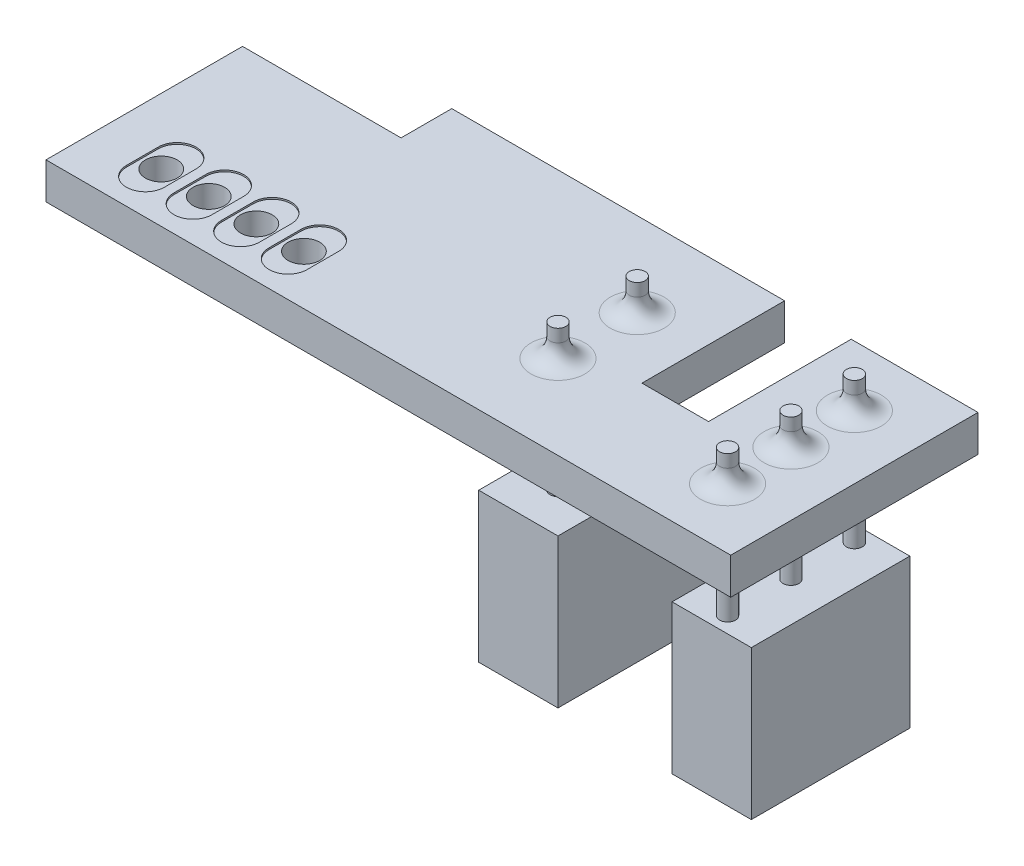
from build123d import *

# Parameters (mm, degrees)
SKETCH1_R                = 0.5
BOSS_EXTRUDE1_DEPTH      = 1.15
BOSS_EXTRUDE2_DEPTH      = 1
BOSS_EXTRUDE2_DEPTH_BACK = 3.6
SKETCH2_R                = 0.25
SKETCH3_W                = 2.5
SKETCH3_H                = 5
BOSS_EXTRUDE3_DEPTH      = 4.7
CUT_EXTRUDE1_DEPTH       = 0.05
FILLET1_R                = 0.6


with BuildPart() as part:
    # Sketch1 → Boss-Extrude1 (new body)
    with BuildSketch(Plane(origin=(0, 0, 0), x_dir=(1, 0, 0), z_dir=(0, 1, 0))):
        Polygon((-16.6, 0), (-16.6, -1.6), (-21.6, -1.6), (-21.6, -7.8), (0, -7.8), (0, 0), (-4, 0), (-4, -4.5), (-6.1, -4.5), (-6.1, 0), align=None)
        with Locations((-19.582016598, -6.182152405)):
            Circle(SKETCH1_R, mode=Mode.SUBTRACT)
        with Locations((-18.082016598, -6.182152405)):
            Circle(SKETCH1_R, mode=Mode.SUBTRACT)
        with Locations((-16.582016598, -6.182152405)):
            Circle(SKETCH1_R, mode=Mode.SUBTRACT)
        with Locations((-15.082016598, -6.182152405)):
            Circle(SKETCH1_R, mode=Mode.SUBTRACT)
    extrude(amount=BOSS_EXTRUDE1_DEPTH)

    # Sketch2 → Boss-Extrude2 (add, two sides: drawn at the far end of the back side and taken through both)
    with BuildSketch(Plane(origin=(0, 1.15, 0), x_dir=(1, 0, 0), z_dir=(0, 1, 0)).offset(-BOSS_EXTRUDE2_DEPTH_BACK)):
        with Locations((-8.1, -2.65)):
            Circle(SKETCH2_R)
        with Locations((-8.1, -5.15)):
            Circle(SKETCH2_R)
        with Locations((-2, -5.9)):
            Circle(SKETCH2_R)
        with Locations((-2, -1.9)):
            Circle(SKETCH2_R)
        with Locations((-2, -3.9)):
            Circle(SKETCH2_R)
    extrude(amount=BOSS_EXTRUDE2_DEPTH + BOSS_EXTRUDE2_DEPTH_BACK)

    # Sketch3 → Boss-Extrude3 (add)
    with BuildSketch(Plane.XZ.offset(2.45)):
        with Locations((-8.1, 3.9)):
            Rectangle(SKETCH3_W, SKETCH3_H)
        with Locations((-2, 3.9)):
            Rectangle(SKETCH3_W, SKETCH3_H)
    extrude(amount=BOSS_EXTRUDE3_DEPTH)

    # Sketch4 → Cut-Extrude1 (cut)
    with BuildSketch(Plane(origin=(0, 1.15, 0), x_dir=(1, 0, 0), z_dir=(0, 1, 0))):
        with BuildLine():
            Line((-15.68022855, -6.682152405), (-15.68022855, -5.682152405))
            ThreePointArc((-15.68022855, -5.682152405), (-15.082016598, -5.083940453), (-14.483804646, -5.682152405))
            Line((-14.483804646, -5.682152405), (-14.483804646, -6.682152405))
            ThreePointArc((-14.483804646, -6.682152405), (-15.082016598, -7.280364357), (-15.68022855, -6.682152405))
        make_face()
        with BuildLine():
            Line((-17.18022855, -6.682152405), (-17.18022855, -5.682152405))
            ThreePointArc((-17.18022855, -5.682152405), (-16.582016598, -5.083940453), (-15.983804646, -5.682152405))
            Line((-15.983804646, -5.682152405), (-15.983804646, -6.682152405))
            ThreePointArc((-15.983804646, -6.682152405), (-16.582016598, -7.280364357), (-17.18022855, -6.682152405))
        make_face()
        with BuildLine():
            Line((-18.68022855, -6.682152405), (-18.68022855, -5.682152405))
            ThreePointArc((-18.68022855, -5.682152405), (-18.082016598, -5.083940453), (-17.483804646, -5.682152405))
            Line((-17.483804646, -5.682152405), (-17.483804646, -6.682152405))
            ThreePointArc((-17.483804646, -6.682152405), (-18.082016598, -7.280364357), (-18.68022855, -6.682152405))
        make_face()
        with BuildLine():
            Line((-20.18022855, -6.682152405), (-20.18022855, -5.682152405))
            ThreePointArc((-20.18022855, -5.682152405), (-19.582016598, -5.083940453), (-18.983804646, -5.682152405))
            Line((-18.983804646, -5.682152405), (-18.983804646, -6.682152405))
            ThreePointArc((-18.983804646, -6.682152405), (-19.582016598, -7.280364357), (-20.18022855, -6.682152405))
        make_face()
    extrude(amount=-CUT_EXTRUDE1_DEPTH, mode=Mode.SUBTRACT)

    # Fillet1
    fillet1_edges = [part.edges().sort_by_distance(p)[0] for p in [
        (-2.25, 1.15, 1.9),
        (-2.25, 1.15, 5.9),
        (-8.35, 1.15, 2.65),
        (-8.35, 1.15, 5.15),
        (-2.25, 1.15, 3.9),
    ]]
    fillet(fillet1_edges, radius=FILLET1_R)


solid = part.part
